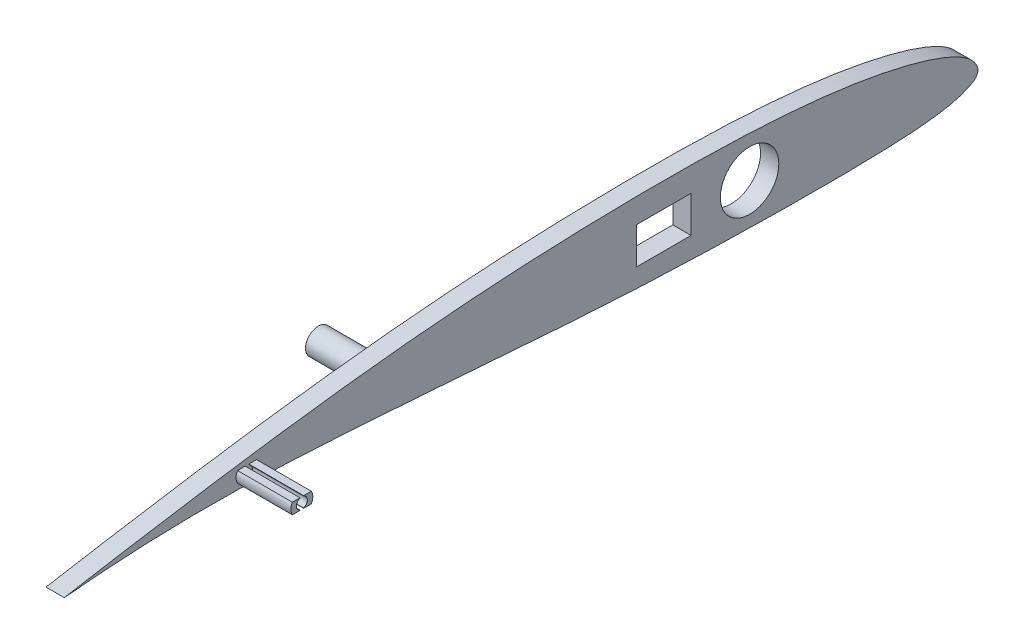
from build123d import *

# Parameters (mm, degrees)
SCHIZZO1_R                  = 8
SCHIZZO1_W                  = 15
SCHIZZO1_H                  = 10
CORPOFOAM_DEPTH             = 5
SCHIZZO2_R                  = 3.5
PERNOAGGANCIO_DEPTH         = 15
PERNOAGGANCIOALETTONE_DEPTH = 15


with BuildPart() as part:
    # Schizzo1 → CorpoFoam (new body)
    with BuildSketch(Plane(origin=(0, 0, 0), x_dir=(0, 0, -1), z_dir=(1, 0, 0))):
        with BuildLine():
            add(Edge.make_bspline(
                [(-250, 0), (-250.000228294, -0.008042796), (-248.284955516, 0.172375658), (-246.518112419, 0.308690015), (-242.189387343, 0.685693594), (-236.806461263, 1.074101529), (-229.680385952, 1.49731724), (-221.184158698, 1.823218603), (-211.337618208, 1.967626101), (-200.371188527, 1.833221056), (-188.499913622, 1.38960529), (-175.953687417, 0.706014078), (-162.931424918, -0.160208642), (-149.615771744, -1.148016327), (-136.176354995, -2.19092491), (-122.767140548, -3.219583979), (-109.520053587, -4.152743127), (-96.546095975, -4.938564365), (-83.940819302, -5.536830703), (-71.801839291, -5.947648205), (-60.245256003, -6.218450939), (-49.398732891, -6.355369756), (-39.397226194, -6.381387963), (-30.361934842, -6.26504923), (-22.412181103, -6.012164917), (-15.626227231, -5.597433901), (-10.071907511, -4.928706579), (-5.697692612, -4.040446981), (-2.625320639, -2.865752984), (-0.494884225, -1.71152847), (0.021312549, -0.410454231), (-0.0311692, 0.792659827), (-0.812599242, 2.305684337), (-2.728863517, 4.238352424), (-5.769907241, 6.118172121), (-9.880942804, 7.913594202), (-15.074930468, 9.641318178), (-21.298752222, 11.283896488), (-28.49717212, 12.788381759), (-36.607373406, 14.097834908), (-45.57302844, 15.159429017), (-55.332910074, 15.960903998), (-65.816536498, 16.494069738), (-76.93137626, 16.791989705), (-88.566949028, 16.864754131), (-100.596999886, 16.726715291), (-112.888825982, 16.383385064), (-125.311615819, 15.825573667), (-137.743791097, 15.05233187), (-150.072384382, 14.059339074), (-162.191375056, 12.881586986), (-173.989074322, 11.549280346), (-185.352364446, 10.116249729), (-196.163081698, 8.632379125), (-206.300441402, 7.131513884), (-215.560350587, 5.731221768), (-223.977157043, 4.293295127), (-231.363413336, 3.181808874), (-237.746440904, 2.098942417), (-242.622069366, 1.245861917), (-246.644529332, 0.552864946), (-248.32839844, 0.246216765), (-249.999773563, 0.007977377), (-250, 0)],
                knots=[0, 0, 0, 0, 0.001588889, 0.006329218, 0.014202456, 0.025172808, 0.039173483, 0.056060631, 0.075578924, 0.097363607, 0.120926258, 0.145825281, 0.171670912, 0.198108537, 0.224790184, 0.25139058, 0.277643491, 0.30332675, 0.328257458, 0.352272548, 0.375156062, 0.396620664, 0.416422729, 0.43430442, 0.45005468, 0.463465465, 0.474478994, 0.483169222, 0.489678354, 0.494104066, 0.496910015, 0.497289785, 0.501214273, 0.50645795, 0.513356957, 0.522168632, 0.53296597, 0.545689209, 0.560220779, 0.576438923, 0.594258689, 0.613600245, 0.634342386, 0.656331109, 0.679351894, 0.703152303, 0.727478208, 0.752070739, 0.776691164, 0.801140184, 0.825214387, 0.848697424, 0.871352858, 0.892947449, 0.913230871, 0.931955467, 0.948342069, 0.963693004, 0.976235918, 0.986320059, 0.993788799, 0.998424035, 1, 1, 1, 1], degree=3))
        make_face()
        with Locations((-62.499919709, 5.077322704)):
            Circle(SCHIZZO1_R, mode=Mode.SUBTRACT)
        with Locations((-85.999919709, 5.077322704)):
            Rectangle(SCHIZZO1_W, SCHIZZO1_H, mode=Mode.SUBTRACT)
    extrude(amount=CORPOFOAM_DEPTH)

    # Schizzo2 → PernoAggancio (add)
    with BuildSketch(Plane.ZY):
        with Locations((160.499919709, 6.077322704)):
            Circle(SCHIZZO2_R)
    extrude(amount=PERNOAGGANCIO_DEPTH)

    # Schizzo3 → PernoAggancioAlettone (add)
    with BuildSketch(Plane(origin=(5, 0, 0), x_dir=(0, 0, -1), z_dir=(1, 0, 0))):
        with BuildLine():
            Line((-197.401923789, 6.41748059), (-199.5, 6.41748059))
            Line((-199.5, 6.41748059), (-199.5, 6.331694152))
            ThreePointArc((-199.5, 6.331694152), (-198.5, 4.91748059), (-199.5, 3.503267027))
            Line((-199.5, 3.503267027), (-199.5, 3.41748059))
            Line((-199.5, 3.41748059), (-197.401923789, 3.41748059))
            ThreePointArc((-197.401923789, 3.41748059), (-197, 4.91748059), (-197.401923789, 6.41748059))
        make_face()
        with BuildLine():
            Line((-200.5, 6.41748059), (-200.5, 6.331694152))
            ThreePointArc((-200.5, 6.331694152), (-201.5, 4.91748059), (-200.5, 3.503267027))
            Line((-200.5, 3.503267027), (-200.5, 3.41748059))
            Line((-200.5, 3.41748059), (-202.598076211, 3.41748059))
            ThreePointArc((-202.598076211, 3.41748059), (-203, 4.91748059), (-202.598076211, 6.41748059))
            Line((-202.598076211, 6.41748059), (-200.5, 6.41748059))
        make_face()
    extrude(amount=PERNOAGGANCIOALETTONE_DEPTH)


solid = part.part
